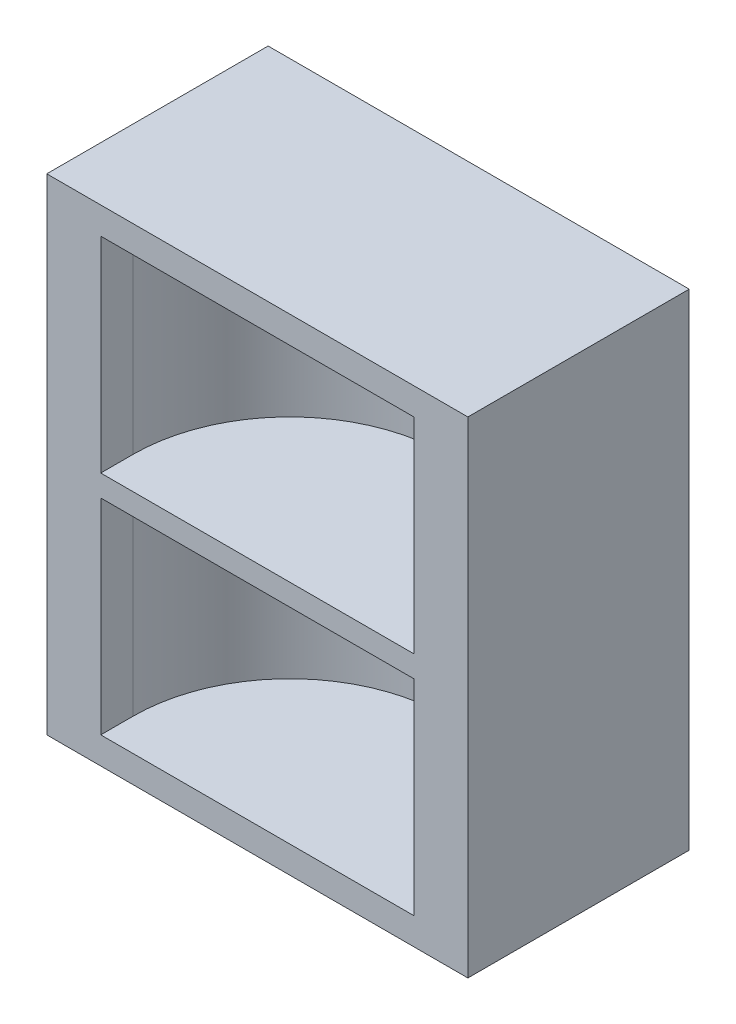
from build123d import *

# Parameters (mm, degrees)
BOSS_EXTRUDE1_DEPTH = 45
SKETCH2_W           = 29
SKETCH2_H           = 38
SKETCH3_W           = 78
SKETCH3_H           = 90
SKETCH3_W_2         = 58
SKETCH3_H_2         = 38
BOSS_EXTRUDE2_DEPTH = 6


with BuildPart() as part:
    # Sketch1 → Boss-Extrude1 (new, symmetric)
    with BuildSketch(Plane(origin=(0, 0, 0), x_dir=(-1, 0, 0), z_dir=(0, 1, 0))):
        Polygon((39, 0), (29, 0), (-29, 0), (-39, 0), (-39, -35), (39, -35), align=None)
    extrude(amount=BOSS_EXTRUDE1_DEPTH, both=True)

    # Sketch2 → Cut-Revolve4 (revolve, cut)
    with BuildSketch(Plane.XY):
        with Locations((-14.5, -21)):
            Rectangle(SKETCH2_W, SKETCH2_H)
        with Locations((-14.5, 21)):
            Rectangle(SKETCH2_W, SKETCH2_H)
    revolve(axis=Axis((0, 45, 0), (0, -1, 0)), mode=Mode.SUBTRACT)

    # Sketch3 → Boss-Extrude2 (add)
    with BuildSketch(Plane.XY):
        Rectangle(SKETCH3_W, SKETCH3_H)
        with Locations((0, -21)):
            Rectangle(SKETCH3_W_2, SKETCH3_H_2, mode=Mode.SUBTRACT)
        with Locations((0, 21)):
            Rectangle(SKETCH3_W_2, SKETCH3_H_2, mode=Mode.SUBTRACT)
    extrude(amount=BOSS_EXTRUDE2_DEPTH)


solid = part.part
